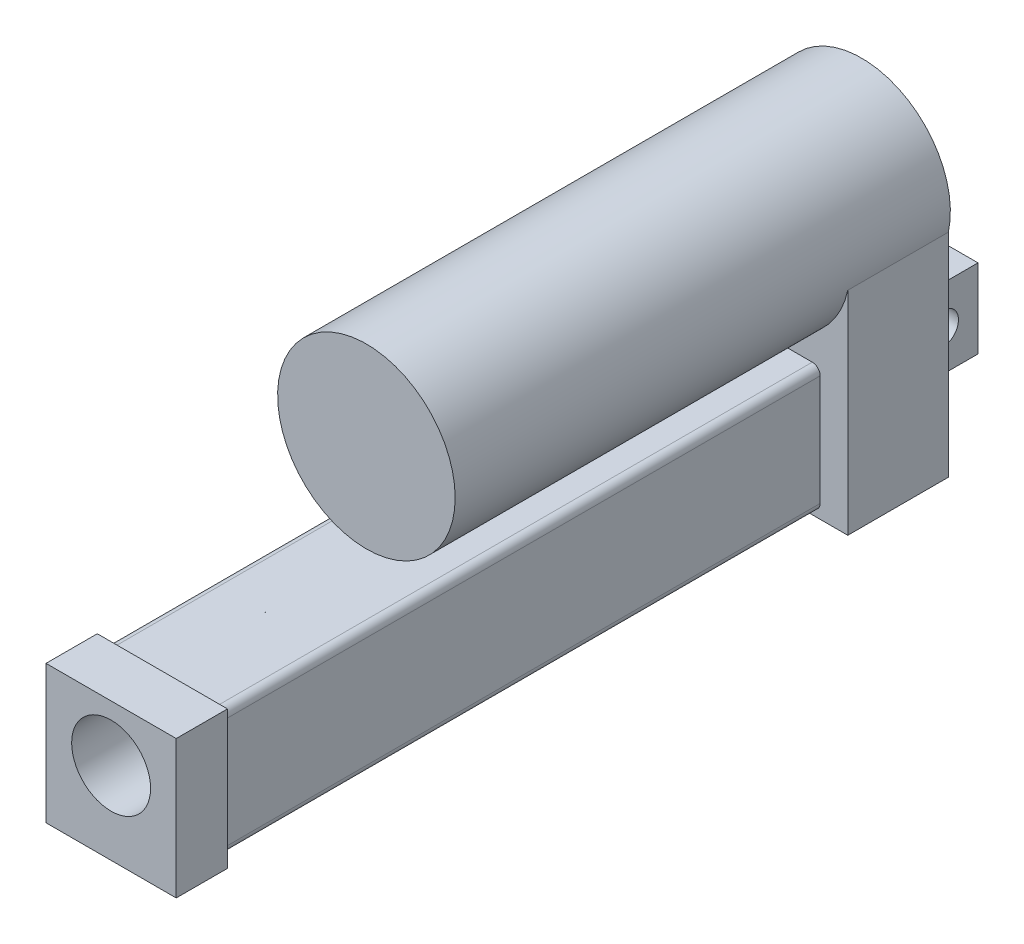
from build123d import *

# Parameters (mm, degrees)
BOSS_EXTRUDE1_DEPTH     = 25.5
SKETCH2_R               = 22.5
BOSS_EXTRUDE2_DEPTH     = 100
SKETCH3_W               = 30
SKETCH3_H               = 32
BOSS_EXTRUDE3_DEPTH     = 164.7
SKETCH4_W               = 19
SKETCH4_H               = 20
BOSS_EXTRUDE4_DEPTH     = 20
SKETCH5_R               = 4.05
CUT_EXTRUDE1_DEPTH      = 202.549720913
SKETCH6_R               = 10
BOSS_EXTRUDE5_DEPTH     = 25
SKETCH7_W               = 33
SKETCH7_H               = 35
BOSS_EXTRUDE6_DEPTH     = 13
CUT_EXTRUDE2_DEPTH      = 225.141785484
CUT_EXTRUDE2_DEPTH_BACK = 225.141785484
SKETCH8_R               = 4.05
FILLET1_R               = 2
CUT_EXTRUDE3_START      = -100
SKETCH9_R               = 10
CUT_EXTRUDE3_DEPTH      = 100


with BuildPart() as part:
    # Sketch1 → Boss-Extrude1 (new body)
    with BuildSketch(Plane.XY):
        with BuildLine():
            Line((-22, -4.716990566), (-22, -58.5))
            Line((-22, -58.5), (22, -58.5))
            Line((22, -58.5), (22, -4.716990566))
            ThreePointArc((22, -4.716990566), (0, 22.5), (-22, -4.716990566))
        make_face()
    extrude(amount=BOSS_EXTRUDE1_DEPTH)

    # Sketch2 → Boss-Extrude2 (add)
    with BuildSketch(Plane.XY.offset(25.5)):
        with Locations(Location((0, 0, 0), (0, 0, 192.101492032))):
            Circle(SKETCH2_R)
    extrude(amount=BOSS_EXTRUDE2_DEPTH)

    # Sketch3 → Boss-Extrude3 (add)
    with BuildSketch(Plane.XY.offset(25.5)):
        with Locations((0, -41)):
            Rectangle(SKETCH3_W, SKETCH3_H)
    extrude(amount=BOSS_EXTRUDE3_DEPTH)

    # Sketch4 → Boss-Extrude4 (add)
    with BuildSketch(Plane(origin=(0, 0, 0), x_dir=(-1, 0, 0), z_dir=(0, 0, -1))):
        with Locations((0, -37.7)):
            Rectangle(SKETCH4_W, SKETCH4_H)
    extrude(amount=BOSS_EXTRUDE4_DEPTH)

    # Sketch5 → Cut-Extrude1 (cut, through all)
    with BuildSketch(Plane(origin=(9.5, 0, 0), x_dir=(0, 0, -1), z_dir=(1, 0, 0))):
        with Locations((11, -37.7)):
            Circle(SKETCH5_R)
    extrude(amount=-CUT_EXTRUDE1_DEPTH, mode=Mode.SUBTRACT)

    # Sketch6 → Boss-Extrude5 (add)
    with BuildSketch(Plane.XY.offset(190.2)):
        with Locations((0, -37.7)):
            Circle(SKETCH6_R)
    extrude(amount=BOSS_EXTRUDE5_DEPTH)

    # Sketch7 → Boss-Extrude6 (add)
    with BuildSketch(Plane.XY.offset(190.2)):
        with Locations((0, -41)):
            Rectangle(SKETCH7_W, SKETCH7_H)
    extrude(amount=-BOSS_EXTRUDE6_DEPTH)

    # Sketch8 → Cut-Extrude2 (cut, two sides: drawn at the far end of the back side and taken through both)
    with BuildSketch(Plane(origin=(0, 0, 0), x_dir=(0, 0, -1), z_dir=(1, 0, 0)).offset(-CUT_EXTRUDE2_DEPTH_BACK)):
        with Locations(Location((-205.2, -37.7, 0), (0, 0, 179.999999993))):
            Circle(SKETCH8_R)
    extrude(amount=CUT_EXTRUDE2_DEPTH + CUT_EXTRUDE2_DEPTH_BACK, mode=Mode.SUBTRACT)

    # Fillet1
    fillet1_edges = [part.edges().sort_by_distance(p)[0] for p in [
        (15, -57, 101.35),
        (-15, -57, 101.35),
        (-15, -25, 101.35),
        (15, -25, 101.35),
    ]]
    fillet(fillet1_edges, radius=FILLET1_R)

    # Sketch9 → Cut-Extrude3 (cut)
    with BuildSketch(Plane.XY.offset(215.2).offset(CUT_EXTRUDE3_START)):
        with Locations((0, -37.7)):
            Circle(SKETCH9_R)
    extrude(amount=CUT_EXTRUDE3_DEPTH, mode=Mode.SUBTRACT)


solid = part.part
